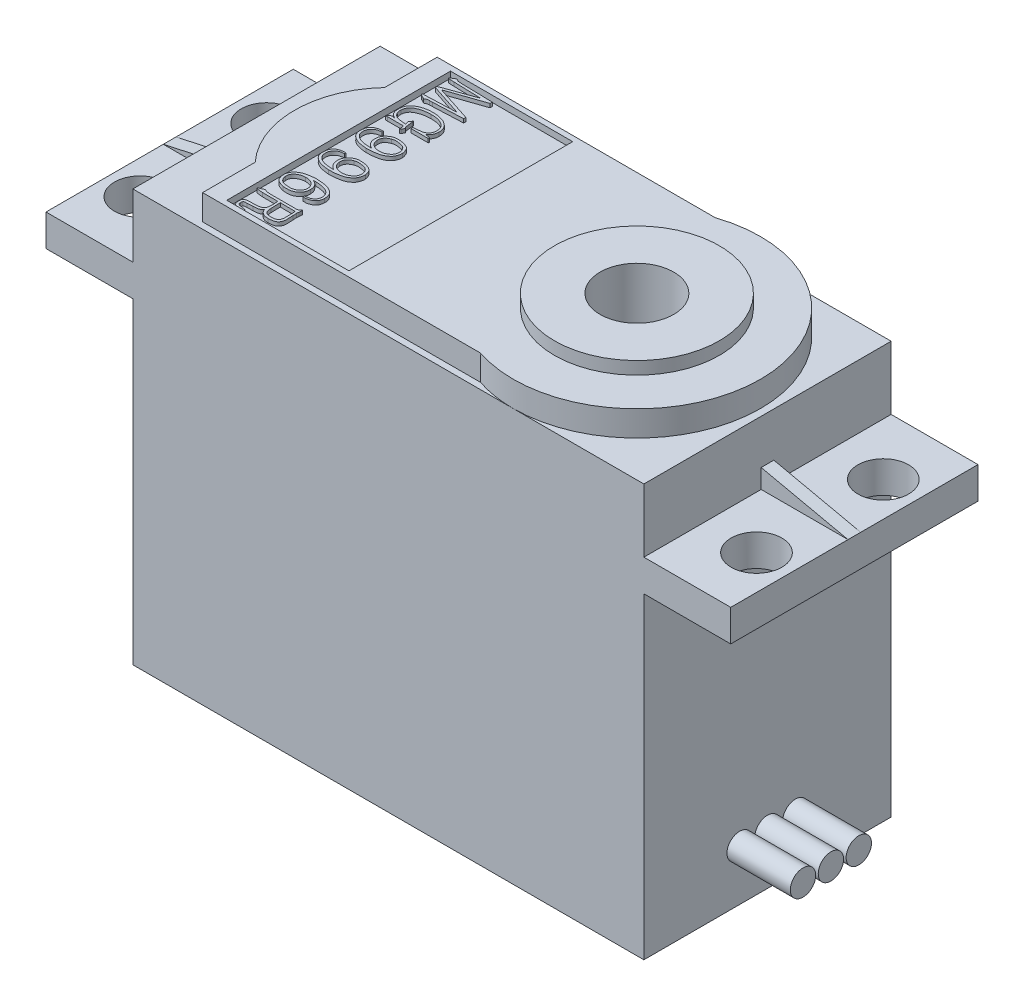
from build123d import *

# Parameters (mm, degrees)
SKETCH_1_W          = 40.3
SKETCH_1_H          = 19.5
EXTRUDE_1_DEPTH     = 27
SKETCH_2_W          = 54
SKETCH_2_H          = 19.5
EXTRUDE_2_DEPTH     = 2.5
SKETCH_3_W          = 40.3
SKETCH_3_H          = 19.5
EXTRUDE_3_DEPTH     = 5
EXTRUDE_4_DEPTH     = 2
RIB_1_REACH         = 48.436
SKETCH_5_WALL_W     = 101.884534654
SKETCH_5_WALL_H     = 1
RIB_2_REACH         = 48.436
SKETCH_6_WALL_W     = 101.884534654
SKETCH_6_WALL_H     = 1
SKETCH_7_R          = 6.5
EXTRUDE_5_DEPTH     = 1
SKETCH_8_R          = 2.9
CUT_EXTRUDE_1_DEPTH = 5
SKETCH_9_R          = 2
CUT_EXTRUDE_2_DEPTH = 5
CHAMFER_1_SIZE      = 2
SKETCH_10_W         = 9.636787174
SKETCH_10_H         = 17.646584306
CUT_EXTRUDE_3_DEPTH = 0.5
EXTRUDE_6_DEPTH     = 0.3
SKETCH_12_R         = 1
EXTRUDE_9_DEPTH     = 5


with BuildPart() as part:
    # 草图1 → 凸台-拉伸1 (new body)
    with BuildSketch(Plane(origin=(0, 0, 0), x_dir=(1, 0, 0), z_dir=(0, 1, 0))):
        Rectangle(SKETCH_1_W, SKETCH_1_H)
    extrude(amount=EXTRUDE_1_DEPTH)

    # 草图2 → 凸台-拉伸2 (add)
    with BuildSketch(Plane(origin=(0, 27, 0), x_dir=(1, 0, 0), z_dir=(0, 1, 0))):
        Rectangle(SKETCH_2_W, SKETCH_2_H)
    extrude(amount=EXTRUDE_2_DEPTH)

    # 草图3 → 凸台-拉伸3 (add)
    with BuildSketch(Plane(origin=(0, 29.5, 0), x_dir=(1, 0, 0), z_dir=(0, 1, 0))):
        Rectangle(SKETCH_3_W, SKETCH_3_H)
    extrude(amount=EXTRUDE_3_DEPTH)

    # 草图4 → 凸台-拉伸4 (add)
    with BuildSketch(Plane(origin=(0, 34.5, 0), x_dir=(1, 0, 0), z_dir=(0, 1, 0))):
        with BuildLine():
            Line((-15.15, -9.25), (-15.15, -5.099019514))
            ThreePointArc((-15.15, -5.099019514), (-17.15, 0), (-15.15, 5.099019514))
            Line((-15.15, 5.099019514), (-15.15, 9.25))
            Line((-15.15, 9.25), (6.767792999, 9.25))
            ThreePointArc((6.767792999, 9.25), (19.6, 0), (6.767792999, -9.25))
            Line((6.767792999, -9.25), (-15.15, -9.25))
        make_face()
    extrude(amount=EXTRUDE_4_DEPTH)

    # 草图5 wall → 筋1 (add, up to next)
    with BuildSketch(Plane(origin=(23.575, 30.25, 0), x_dir=(0.976853477736, -0.213909520672, 0), z_dir=(0.213909520672, 0.976853477736, 0)), mode=Mode.PRIVATE) as rib_1_sk1:
        Rectangle(SKETCH_5_WALL_W, SKETCH_5_WALL_H)
    rib_1_tool1 = extrude(rib_1_sk1.sketch, amount=-RIB_1_REACH, mode=Mode.PRIVATE) - part.part
    add(rib_1_tool1.solids().sort_by_distance((23.575, 30.25, 0))[0])

    # 草图6 wall → 筋2 (add, up to next)
    with BuildSketch(Plane(origin=(-23.575, 30.25, 0), x_dir=(-0.976853477736, -0.213909520672, 0), z_dir=(0.213909520672, -0.976853477736, 0)), mode=Mode.PRIVATE) as rib_2_sk1:
        Rectangle(SKETCH_6_WALL_W, SKETCH_6_WALL_H)
    rib_2_tool1 = extrude(rib_2_sk1.sketch, amount=RIB_2_REACH, mode=Mode.PRIVATE) - part.part
    add(rib_2_tool1.solids().sort_by_distance((-23.575, 30.25, 0))[0])

    # 草图7 → 凸台-拉伸5 (add)
    with BuildSketch(Plane(origin=(0, 36.5, 0), x_dir=(1, 0, 0), z_dir=(0, 1, 0))):
        with Locations(Location((9.85, 0, 0), (0, 0, 270))):
            Circle(SKETCH_7_R)
    extrude(amount=EXTRUDE_5_DEPTH)

    # 草图8 → 切除-拉伸1 (cut)
    with BuildSketch(Plane(origin=(0, 37.5, 0), x_dir=(1, 0, 0), z_dir=(0, 1, 0))):
        with Locations(Location((9.85, 0, 0), (0, 0, 270))):
            Circle(SKETCH_8_R)
    extrude(amount=-CUT_EXTRUDE_1_DEPTH, mode=Mode.SUBTRACT)

    # 草图9 → 切除-拉伸2 (cut)
    with BuildSketch(Plane(origin=(0, 29.5, 0), x_dir=(1, 0, 0), z_dir=(0, 1, 0))):
        with Locations(Location((-24.35, 5, 0), (0, 0, 270))):
            Circle(SKETCH_9_R)
        with Locations(Location((24.28, 5, 0), (0, 0, 270))):
            Circle(SKETCH_9_R)
        with Locations(Location((24.28, -5, 0), (0, 0, 270))):
            Circle(SKETCH_9_R)
        with Locations(Location((-24.35, -5, 0), (0, 0, 270))):
            Circle(SKETCH_9_R)
    extrude(amount=-CUT_EXTRUDE_2_DEPTH, mode=Mode.SUBTRACT)

    # 倒角1
    chamfer_1_edges = [part.edges().sort_by_distance(p)[0] for p in [
        (0, 0, 9.75),
        (-20.15, 0, 0),
        (0, 0, -9.75),
        (20.15, 0, 0),
    ]]
    chamfer(chamfer_1_edges, length=CHAMFER_1_SIZE)

    # 草图10 → 切除-拉伸3 (cut)
    with BuildSketch(Plane(origin=(0, 36.5, 0), x_dir=(1, 0, 0), z_dir=(0, 1, 0))):
        with Locations((-8.854580423, 0)):
            Rectangle(SKETCH_10_W, SKETCH_10_H)
    extrude(amount=-CUT_EXTRUDE_3_DEPTH, mode=Mode.SUBTRACT)

    # 草图11 → 凸台-拉伸6 (add)
    # profile 1 of 6: a face of its own
    with BuildSketch(Plane(origin=(0, 36, 0), x_dir=(1, 0, 0), z_dir=(0, 1, 0))):
        with BuildLine():
            Line((-10.108835932, 6.465099099), (-10.108835932, 6.292075447))
            Line((-10.108835932, 6.292075447), (-12.470012152, 6.186918831))
            Line((-12.470012152, 6.186918831), (-12.691512258, 6.179460915))
            add(Edge.make_bspline(
                [(-12.691512258, 6.179460915), (-12.704682236, 6.179133247), (-12.729283425, 6.178521171), (-12.76346004, 6.178820017), (-12.791956525, 6.175085343), (-12.82366459, 6.171706911), (-12.861096032, 6.161497876), (-12.905501006, 6.14652074), (-12.948600061, 6.12856097), (-12.983579582, 6.105935535), (-13.009940886, 6.088203492), (-13.030941587, 6.076001018), (-13.052071154, 6.081143252), (-13.07675673, 6.092617885), (-13.114417302, 6.110357592), (-13.1428217, 6.125832205), (-13.159123594, 6.134713418)],
                knots=[0, 0, 0, 0, 1.102701008, 2.059818031, 2.854660456, 3.504867835, 4.725821617, 6.087517188, 7.428720521, 8.623884165, 9.541296161, 10.147772796, 10.527373255, 11.292252643, 12.445965619, 14, 14, 14, 14], degree=3))
            Line((-13.159123594, 6.134713418), (-13.330655663, 6.217496286))
            add(Edge.make_bspline(
                [(-13.330655663, 6.217496286), (-13.346301752, 6.226705906), (-13.373957393, 6.242984603), (-13.410242295, 6.264089838), (-13.434260872, 6.280820261), (-13.451111532, 6.295883627), (-13.457639739, 6.312784037), (-13.460491623, 6.329808581), (-13.454018711, 6.344742876), (-13.445383369, 6.349890937), (-13.441032821, 6.352484567)],
                knots=[0, 0, 0, 0, 2.092832486, 3.699239191, 4.828075347, 5.47623227, 6.258606608, 6.862868476, 7.427104806, 8, 8, 8, 8], degree=3))
            add(Edge.make_bspline(
                [(-13.441032821, 6.352484567), (-13.435046209, 6.357006622), (-13.420471597, 6.368015719), (-13.386613915, 6.370427585), (-13.342683956, 6.368829873), (-13.309272674, 6.363152374), (-13.290382917, 6.359942483)],
                knots=[0, 0, 0, 0, 0.570562757, 1.389054623, 2.523848169, 4, 4, 4, 4], degree=3))
            Line((-13.290382917, 6.359942483), (-12.973421485, 6.374858315))
            Line((-12.973421485, 6.374858315), (-10.793472625, 6.465099099))
            Line((-10.793472625, 6.465099099), (-13.350792036, 7.306352029))
            Line((-13.350792036, 7.306352029), (-13.345571495, 7.448798226))
            Line((-13.345571495, 7.448798226), (-10.823304289, 8.357918191))
            Line((-10.823304289, 8.357918191), (-12.998032608, 8.41758152))
            Line((-12.998032608, 8.41758152), (-13.31051929, 8.432497352))
            add(Edge.make_bspline(
                [(-13.31051929, 8.432497352), (-13.333162395, 8.433096925), (-13.373834867, 8.434173904), (-13.421285793, 8.442738496), (-13.449423132, 8.454520513), (-13.463828559, 8.462840882), (-13.47192037, 8.474097008), (-13.471707613, 8.481885371), (-13.471610276, 8.485448556)],
                knots=[0, 0, 0, 0, 2.238805083, 4.021433183, 4.714937999, 5.246364549, 5.655210975, 6, 6, 6, 6], degree=3))
            add(Edge.make_bspline(
                [(-13.471610276, 8.485448556), (-13.471003507, 8.490422698), (-13.469760989, 8.500608544), (-13.464368444, 8.518920478), (-13.441676521, 8.536983875), (-13.414414844, 8.549644392), (-13.389590289, 8.562388056), (-13.373328787, 8.568741699), (-13.363189557, 8.57381118), (-13.357766391, 8.57523038), (-13.356012578, 8.57568934)],
                knots=[0, 0, 0, 0, 0.773964204, 1.584892381, 2.85704835, 5.031717749, 6.264108979, 7.138477416, 7.721389708, 8, 8, 8, 8], degree=3))
            Line((-13.356012578, 8.57568934), (-13.12929193, 8.71067762))
            add(Edge.make_bspline(
                [(-13.12929193, 8.71067762), (-13.118000132, 8.714835489), (-13.096054756, 8.722916221), (-13.059642734, 8.719188617), (-13.021934201, 8.706021239), (-12.983971195, 8.684010086), (-12.947744176, 8.664578412), (-12.922530612, 8.648111569), (-12.902132595, 8.640318917), (-12.88212722, 8.635425917), (-12.855703991, 8.631003339), (-12.824755874, 8.627925206), (-12.793918658, 8.624541087), (-12.76736622, 8.621186615), (-12.747347371, 8.619676373), (-12.733594573, 8.616659085), (-12.721571031, 8.615919225), (-12.707482285, 8.613910168), (-12.687009353, 8.613953079), (-12.660454325, 8.611939052), (-12.62762641, 8.610625844), (-12.588826672, 8.609354422), (-12.543871504, 8.606605495), (-12.511781227, 8.605898838), (-12.494623275, 8.605521004)],
                knots=[0, 0, 0, 0, 1.194424872, 2.321340004, 3.585598028, 5.195084956, 6.716837907, 7.724099835, 8.206680761, 8.903637039, 9.790942755, 10.897450691, 12.028789452, 12.90903052, 13.587833776, 14.043805438, 14.319796903, 14.797174648, 15.472288729, 16.373211185, 17.473778476, 18.774068007, 20.27516646, 22, 22, 22, 22], degree=3))
            Line((-12.494623275, 8.605521004), (-10.108835932, 8.5525698))
            Line((-10.108835932, 8.5525698), (-10.108835932, 8.372834024))
            Line((-10.108835932, 8.372834024), (-12.957759861, 7.389134897))
            Line((-12.957759861, 7.389134897), (-10.108835932, 6.465099099))
        make_face()
    # profile 2 of 6: a face of its own
    with BuildSketch(Plane(origin=(0, 36, 0), x_dir=(1, 0, 0), z_dir=(0, 1, 0))):
        with BuildLine():
            add(Edge.make_bspline(
                [(-12.016570856, 3.633097388), (-12.021647518, 3.652280636), (-12.03076964, 3.68675051), (-12.044719979, 3.731948407), (-12.053858919, 3.765503045), (-12.059780228, 3.783512837), (-12.062064144, 3.790459417)],
                knots=[0, 0, 0, 0, 1.45335447, 2.611494566, 3.464437835, 4, 4, 4, 4], degree=3))
            Line((-12.062064144, 3.790459417), (-12.091895808, 3.880700201))
            Line((-12.091895808, 3.880700201), (-11.961382277, 4.091013434))
            add(Edge.make_bspline(
                [(-11.961382277, 4.091013434), (-11.95764498, 4.098911304), (-11.951203836, 4.112523098), (-11.9402981, 4.127653424), (-11.932880434, 4.139131161), (-11.921639555, 4.141195757), (-11.912024596, 4.136085521), (-11.902286107, 4.128530848), (-11.895018331, 4.115280171), (-11.892214574, 4.104775229), (-11.890532075, 4.09847135)],
                knots=[0, 0, 0, 0, 1.721478549, 2.96692782, 3.770230587, 4.273468087, 5.07068514, 5.841502061, 6.704713207, 8, 8, 8, 8], degree=3))
            Line((-11.890532075, 4.09847135), (-11.890532075, 3.918735573))
            Line((-11.890532075, 3.918735573), (-11.865920952, 3.760627753))
            Line((-11.865920952, 3.760627753), (-11.840564037, 3.565230352))
            add(Edge.make_bspline(
                [(-11.840564037, 3.565230352), (-11.840162028, 3.559252954), (-11.839235864, 3.545481981), (-11.835041955, 3.522132366), (-11.829179632, 3.492957832), (-11.820824383, 3.460321199), (-11.810937942, 3.428741104), (-11.801494117, 3.402090312), (-11.791997148, 3.382421014), (-11.783550362, 3.373442244), (-11.780154917, 3.369832952)],
                knots=[0, 0, 0, 0, 0.693923818, 1.598689782, 2.745819235, 4.143502487, 5.501415895, 6.57721006, 7.428066009, 8, 8, 8, 8], degree=3))
            Line((-11.780154917, 3.369832952), (-11.729441088, 3.325085456))
            Line((-11.729441088, 3.325085456), (-11.865920952, 3.099856391))
            add(Edge.make_bspline(
                [(-11.865920952, 3.099856391), (-11.87243382, 3.091409429), (-11.884179754, 3.076175366), (-11.909245223, 3.068627838), (-11.930942215, 3.070906442), (-11.938114446, 3.080675364), (-11.941245904, 3.084940559)],
                knots=[0, 0, 0, 0, 1.365288393, 2.462292284, 3.328623616, 4, 4, 4, 4], degree=3))
            Line((-11.941245904, 3.084940559), (-11.946466445, 3.137145971))
            Line((-11.946466445, 3.137145971), (-11.976298109, 3.422784156))
            Line((-11.976298109, 3.422784156), (-13.229973797, 3.422784156))
            add(Edge.make_bspline(
                [(-13.229973797, 3.422784156), (-13.244392973, 3.422738407), (-13.271493518, 3.422652422), (-13.309039452, 3.423205097), (-13.340625763, 3.42499793), (-13.365941229, 3.426048294), (-13.385578137, 3.428418335), (-13.398365183, 3.430384001), (-13.407429015, 3.432443232), (-13.411696813, 3.445012453), (-13.385309586, 3.460625178), (-13.36488436, 3.486651192), (-13.336295309, 3.511054655), (-13.317530409, 3.523347721), (-13.31051929, 3.527940772)],
                knots=[0, 0, 0, 0, 1.639098295, 3.080651418, 4.268929633, 5.231441294, 5.971084531, 6.486786894, 6.765118723, 6.917305179, 7.861808722, 9.440596986, 11.043731724, 12, 12, 12, 12], degree=3))
            Line((-13.31051929, 3.527940772), (-13.244889629, 3.565230352))
            Line((-13.244889629, 3.565230352), (-13.159123594, 3.633097388))
            add(Edge.make_bspline(
                [(-13.159123594, 3.633097388), (-13.146154335, 3.644078661), (-13.123962245, 3.662869046), (-13.095589921, 3.668179848), (-13.083798642, 3.670386969)],
                knots=[0, 0, 0, 0, 1.168818219, 2, 2, 2, 2], degree=3))
            Line((-13.083798642, 3.670386969), (-13.033830605, 3.64801322))
            Line((-13.033830605, 3.64801322), (-12.852603245, 3.603265724))
            add(Edge.make_bspline(
                [(-12.852603245, 3.603265724), (-12.867399777, 3.612186044), (-12.903250392, 3.633799144), (-12.968893526, 3.664498462), (-13.047123989, 3.711006729), (-13.117809344, 3.760299608), (-13.174934311, 3.811766987), (-13.213339127, 3.862889077), (-13.248589014, 3.922388097), (-13.279385523, 3.990143332), (-13.303949319, 4.064058483), (-13.323898904, 4.140922715), (-13.335616519, 4.220456159), (-13.338762673, 4.274196694), (-13.340350954, 4.301326666)],
                knots=[0, 0, 0, 0, 0.682902113, 1.654608042, 2.861894888, 4.27790553, 5.056999099, 5.890804738, 6.7945336, 7.788805481, 8.827203978, 9.871588867, 10.925508771, 12, 12, 12, 12], degree=3))
            add(Edge.make_bspline(
                [(-13.340350954, 4.301326666), (-13.341940522, 4.350836096), (-13.345091513, 4.448978324), (-13.326442491, 4.592912429), (-13.292190675, 4.726681274), (-13.25368063, 4.830601442), (-13.213612534, 4.906343899), (-13.177069526, 4.960352736), (-13.135370597, 5.013586381), (-13.086579538, 5.065131773), (-13.030565256, 5.115198821), (-12.968467346, 5.165453956), (-12.897407972, 5.212437881), (-12.821414587, 5.26072982), (-12.73809616, 5.304610792), (-12.649992499, 5.346457258), (-12.555596708, 5.381607507), (-12.457731362, 5.413206976), (-12.358925393, 5.440526842), (-12.262587694, 5.46268715), (-12.170095629, 5.480355716), (-12.0495276, 5.496170554), (-11.893992789, 5.507582247), (-11.698364174, 5.512172169), (-11.490086988, 5.505114558), (-11.348942954, 5.483844991), (-11.276745584, 5.472965277)],
                knots=[0, 0, 0, 0, 1.296855289, 2.57074797, 3.787781431, 4.912090985, 5.466017155, 6.029935049, 6.619226251, 7.236981103, 7.887517514, 8.587730122, 9.328811339, 10.1190631, 10.947078726, 11.7954872, 12.674165492, 13.585070334, 14.490996303, 15.360442995, 16.175900064, 16.95837495, 18.546785394, 20.261144089, 22.087517035, 24, 24, 24, 24], degree=3))
            add(Edge.make_bspline(
                [(-11.276745584, 5.472965277), (-11.216348356, 5.460773639), (-11.091172659, 5.435505976), (-10.936361232, 5.387401561), (-10.81054485, 5.339150776), (-10.716945988, 5.294161799), (-10.626009385, 5.2411581), (-10.539301178, 5.181241338), (-10.458164336, 5.117914641), (-10.38874973, 5.049025594), (-10.330268829, 4.977785742), (-10.28462195, 4.904086956), (-10.249144363, 4.832119898), (-10.219122017, 4.765825903), (-10.198344634, 4.704467913), (-10.178965571, 4.62962431), (-10.166206376, 4.535641468), (-10.161318651, 4.460208543), (-10.158803969, 4.421399114)],
                knots=[0, 0, 0, 0, 1.756852838, 3.641148545, 4.615675158, 5.598961219, 6.599988407, 7.614985252, 8.604008524, 9.53171328, 10.398925515, 11.227312903, 11.997988587, 12.687082964, 13.301564504, 13.84336769, 14.890435854, 16, 16, 16, 16], degree=3))
            add(Edge.make_bspline(
                [(-10.158803969, 4.421399114), (-10.159141256, 4.39701416), (-10.159800316, 4.349365888), (-10.167630771, 4.279849194), (-10.179363786, 4.213999276), (-10.201223391, 4.131357165), (-10.2408323, 4.032759587), (-10.296319275, 3.943804905), (-10.343832513, 3.880375629), (-10.374724041, 3.840206157), (-10.400800081, 3.808079983), (-10.418222387, 3.790601084), (-10.425797364, 3.783001501)],
                knots=[0, 0, 0, 0, 1.02865205, 2.009989184, 2.948380583, 3.849248544, 5.614353784, 7.40828352, 8.256022902, 8.959034023, 9.547402437, 10, 10, 10, 10], degree=3))
            Line((-10.425797364, 3.783001501), (-10.506342857, 3.723338172))
            Line((-10.506342857, 3.723338172), (-10.149108678, 3.633097388))
            Line((-10.149108678, 3.633097388), (-10.149108678, 3.542856604))
            Line((-10.149108678, 3.542856604), (-11.513161523, 3.542856604))
            Line((-11.513161523, 3.542856604), (-11.518382064, 3.700964424))
            add(Edge.make_bspline(
                [(-11.518382064, 3.700964424), (-11.494516912, 3.700993837), (-11.443306274, 3.701056952), (-11.362996534, 3.700518785), (-11.277679241, 3.702741595), (-11.204310309, 3.706944425), (-11.142412917, 3.71285101), (-11.089765308, 3.719851413), (-11.030540559, 3.727917603), (-10.945737283, 3.741418456), (-10.843168344, 3.761391359), (-10.728025613, 3.794020556), (-10.624300382, 3.846026221), (-10.545049291, 3.90394052), (-10.486576367, 3.9598194), (-10.448308991, 4.006569324), (-10.415692478, 4.056163292), (-10.389682737, 4.109701182), (-10.368430427, 4.166860401), (-10.353527533, 4.228313927), (-10.340794228, 4.293429615), (-10.337334012, 4.33855561), (-10.335556579, 4.361735786)],
                knots=[0, 0, 0, 0, 0.935739115, 2.007940184, 3.148747064, 4.28148865, 4.888643423, 5.586238389, 6.363702558, 7.232250513, 8.952694186, 10.46050143, 11.907734915, 13.477168468, 14.290584882, 15.073104099, 15.840915301, 16.612491364, 17.401961071, 18.22703269, 19.08926784, 20, 20, 20, 20], degree=3))
            add(Edge.make_bspline(
                [(-10.335556579, 4.361735786), (-10.335580197, 4.397066303), (-10.335625925, 4.465472279), (-10.347582513, 4.565124053), (-10.37015442, 4.65780567), (-10.401475804, 4.745057683), (-10.444097366, 4.826727585), (-10.500686167, 4.901700191), (-10.567916464, 4.972556241), (-10.647656039, 5.035118281), (-10.733041407, 5.091670803), (-10.8214353, 5.141257933), (-10.911764576, 5.182876201), (-11.00429001, 5.213827957), (-11.09535869, 5.240115387), (-11.184887601, 5.25998781), (-11.271589532, 5.276293122), (-11.384409812, 5.288266877), (-11.523188684, 5.297704281), (-11.633961755, 5.29919746), (-11.689168342, 5.299941624)],
                knots=[0, 0, 0, 0, 1.020336309, 1.975547117, 2.892045996, 3.771563378, 4.648848181, 5.542539332, 6.477435802, 7.463615751, 8.463825308, 9.435109215, 10.389941754, 11.332781131, 12.251473469, 13.128081502, 13.982025083, 14.799156052, 16.404777764, 18, 18, 18, 18], degree=3))
            add(Edge.make_bspline(
                [(-11.689168342, 5.299941624), (-11.724974246, 5.299471703), (-11.798136937, 5.298511507), (-11.909638669, 5.291772929), (-12.025001156, 5.279418405), (-12.14221632, 5.263456395), (-12.258135948, 5.243300153), (-12.368366602, 5.217110383), (-12.471587762, 5.186846331), (-12.566628434, 5.151572511), (-12.653503114, 5.11472244), (-12.730847334, 5.076515869), (-12.799523511, 5.039492682), (-12.859015828, 5.00117928), (-12.911027122, 4.961688993), (-12.958378925, 4.921762301), (-12.998043298, 4.877093274), (-13.045568035, 4.817749644), (-13.091724475, 4.738586852), (-13.134206575, 4.639833837), (-13.161405891, 4.533647798), (-13.166770118, 4.459846685), (-13.169564677, 4.421399114)],
                knots=[0, 0, 0, 0, 1.126994854, 2.302803905, 3.514286971, 4.778011192, 6.025865863, 7.215856767, 8.342308229, 9.409248108, 10.404825957, 11.311169663, 12.123616097, 12.859383373, 13.535435401, 14.178772448, 14.804598141, 15.411954719, 16.570030134, 17.674526722, 18.788516934, 20, 20, 20, 20], degree=3))
            add(Edge.make_bspline(
                [(-13.169564677, 4.421399114), (-13.16985608, 4.386316288), (-13.170441224, 4.315869475), (-13.157030293, 4.210912261), (-13.129869876, 4.109408321), (-13.087395742, 4.013953017), (-13.027141284, 3.928054887), (-12.952783995, 3.851832096), (-12.864987057, 3.789441367), (-12.767751494, 3.743352468), (-12.666254484, 3.71188741), (-12.564462631, 3.687752023), (-12.465114221, 3.673085447), (-12.368574285, 3.658374033), (-12.2702776, 3.647930969), (-12.203034871, 3.6430834), (-12.167966552, 3.640555304)],
                knots=[0, 0, 0, 0, 1.012518681, 2.033151841, 3.045161207, 4.038142276, 5.034026654, 6.059673631, 7.099696739, 8.127377512, 9.153727986, 10.16390169, 11.146023905, 12.052814435, 12.984506943, 14, 14, 14, 14], degree=3))
            Line((-12.167966552, 3.640555304), (-12.016570856, 3.633097388))
        make_face()
    # profile 3 of 6: a face of its own
    with BuildSketch(Plane(origin=(0, 36, 0), x_dir=(1, 0, 0), z_dir=(0, 1, 0))):
        with BuildLine():
            Line((-12.414077781, 2.268813555), (-12.414077781, 2.163656939))
            add(Edge.make_bspline(
                [(-12.414077781, 2.163656939), (-12.44542573, 2.160668995), (-12.507048225, 2.15479542), (-12.599993343, 2.141611829), (-12.696043038, 2.119254882), (-12.779345352, 2.091657499), (-12.849455582, 2.061763536), (-12.90176306, 2.029299544), (-12.954267596, 1.991653222), (-13.004197507, 1.946110866), (-13.051863982, 1.895943641), (-13.09468963, 1.840664874), (-13.131044182, 1.780210269), (-13.163353959, 1.716833701), (-13.188384197, 1.649106561), (-13.204328061, 1.577873112), (-13.213950786, 1.503412625), (-13.212825702, 1.427435802), (-13.207542935, 1.353594204), (-13.195936167, 1.28540785), (-13.181675372, 1.223692734), (-13.161066901, 1.167376939), (-13.132366663, 1.113616899), (-13.092264796, 1.060977341), (-13.043956236, 1.004929239), (-12.985498039, 0.947722114), (-12.916594011, 0.893202795), (-12.838495744, 0.842610722), (-12.750613574, 0.79907992), (-12.654824026, 0.760562789), (-12.551714342, 0.727991537), (-12.443203192, 0.701101815), (-12.32995949, 0.676969593), (-12.252330612, 0.666814914), (-12.212714048, 0.661632647)],
                knots=[0, 0, 0, 0, 1.161562506, 2.283351267, 3.460054047, 4.793976417, 5.516494263, 6.265077708, 7.059282141, 7.896977086, 8.753286989, 9.609842358, 10.470120195, 11.351831039, 12.23086742, 13.125078708, 14.039560616, 14.993248057, 15.92232611, 16.76806327, 17.542052076, 18.255787675, 18.973752159, 19.780770556, 20.690874171, 21.702495583, 22.792346145, 23.926806676, 25.12840101, 26.40383237, 27.73206904, 29.113223073, 30.526782984, 32, 32, 32, 32], degree=3))
            Line((-12.212714048, 0.661632647), (-11.915888989, 0.646716815))
            Line((-11.915888989, 0.646716815), (-11.719745797, 0.639258899))
            add(Edge.make_bspline(
                [(-11.719745797, 0.639258899), (-11.739747007, 0.649746172), (-11.777613157, 0.669600603), (-11.829647537, 0.700882217), (-11.875894713, 0.727884953), (-11.929015728, 0.761979623), (-11.988661304, 0.812380244), (-12.043950603, 0.870692419), (-12.085779294, 0.926515077), (-12.117480445, 0.975061982), (-12.14630396, 1.030681831), (-12.177392739, 1.090661998), (-12.202692749, 1.158498399), (-12.220518193, 1.234120407), (-12.230705647, 1.317153045), (-12.232116873, 1.375077846), (-12.232850421, 1.405186877)],
                knots=[0, 0, 0, 0, 0.96811683, 1.832831972, 2.602442467, 3.264690643, 4.536676004, 5.939331142, 6.700405402, 7.525311046, 8.421957077, 9.384896146, 10.420381823, 11.516576881, 12.70912866, 14, 14, 14, 14], degree=3))
            add(Edge.make_bspline(
                [(-12.232850421, 1.405186877), (-12.232715044, 1.449026481), (-12.232449848, 1.534905208), (-12.212699941, 1.640486274), (-12.186644903, 1.719994074), (-12.162684317, 1.778346849), (-12.132631424, 1.834798489), (-12.097562987, 1.890410817), (-12.055776597, 1.94448805), (-12.008560622, 1.997956038), (-11.953797877, 2.049877041), (-11.893834962, 2.10023768), (-11.830173425, 2.147798751), (-11.762997505, 2.188242095), (-11.694714092, 2.222513156), (-11.62396715, 2.250845196), (-11.549306263, 2.272538726), (-11.469224025, 2.288256456), (-11.382844054, 2.296882908), (-11.260569601, 2.300125219), (-11.106204748, 2.294580826), (-10.98404056, 2.277305763), (-10.923986155, 2.268813555)],
                knots=[0, 0, 0, 0, 1.441778134, 2.824342836, 3.513038675, 4.195722577, 4.898866133, 5.616586851, 6.358372924, 7.147065104, 7.963527037, 8.8409299, 9.725181631, 10.577472986, 11.419597639, 12.23905066, 13.08363918, 13.976378112, 14.923014095, 15.938750632, 18.003540029, 20, 20, 20, 20], degree=3))
            add(Edge.make_bspline(
                [(-10.923986155, 2.268813555), (-10.89431214, 2.263797098), (-10.832400256, 2.253330757), (-10.736909571, 2.227575847), (-10.636121448, 2.190028632), (-10.548601466, 2.153968912), (-10.479055449, 2.119308712), (-10.430340779, 2.089427208), (-10.386378535, 2.056477276), (-10.346184972, 2.021323467), (-10.310999484, 1.98261503), (-10.281502191, 1.94023537), (-10.254374513, 1.896272028), (-10.228587781, 1.833771264), (-10.202149444, 1.758760775), (-10.175310411, 1.675493616), (-10.157268708, 1.601213243), (-10.151693191, 1.554411864), (-10.149108678, 1.532717242)],
                knots=[0, 0, 0, 0, 1.232643308, 2.571787759, 4.044217922, 5.637139245, 6.447978167, 7.225371298, 7.975044785, 8.696580882, 9.410528117, 10.111496744, 10.810241716, 11.521787165, 12.874996824, 14.070206042, 15.105450454, 16, 16, 16, 16], degree=3))
            add(Edge.make_bspline(
                [(-10.149108678, 1.532717242), (-10.148474471, 1.497131692), (-10.147174111, 1.424168163), (-10.159725114, 1.331624044), (-10.176970542, 1.253800505), (-10.197746889, 1.190486256), (-10.223945955, 1.122101322), (-10.256518063, 1.050671028), (-10.296219652, 0.979619787), (-10.342981608, 0.912505364), (-10.398816039, 0.852768739), (-10.481218537, 0.782401301), (-10.590159926, 0.706551752), (-10.702718624, 0.636388884), (-10.802451085, 0.591070664), (-10.890407058, 0.560855999), (-10.991901327, 0.533690314), (-11.102061735, 0.510277211), (-11.210922839, 0.49216258), (-11.307638352, 0.474093707), (-11.388361881, 0.46199144), (-11.475294925, 0.448049735), (-11.579819865, 0.438001365), (-11.705515358, 0.432235999), (-11.827623089, 0.429412303), (-11.90569547, 0.429091668), (-11.941245904, 0.428945667)],
                knots=[0, 0, 0, 0, 1.074749016, 2.203632703, 2.812577277, 3.482852542, 4.21560841, 5.02606841, 5.853870657, 6.673375128, 7.49239699, 8.318183911, 9.94494759, 11.501953483, 12.319249415, 13.250994979, 14.31026013, 15.493928427, 16.654173563, 17.646367651, 18.468040354, 19.121719855, 20.307771699, 21.639741468, 22.925250984, 24, 24, 24, 24], degree=3))
            add(Edge.make_bspline(
                [(-11.941245904, 0.428945667), (-12.000685926, 0.434376772), (-12.114260558, 0.44475422), (-12.277414462, 0.464219139), (-12.427770637, 0.490523193), (-12.570046067, 0.519513745), (-12.706224597, 0.562023525), (-12.817501853, 0.604801875), (-12.905087559, 0.649661861), (-12.971897296, 0.690068724), (-13.040066252, 0.736383915), (-13.107031353, 0.788402602), (-13.170946404, 0.842944433), (-13.223552267, 0.902912875), (-13.268981409, 0.961934293), (-13.301039695, 1.024074528), (-13.326762685, 1.084540206), (-13.345285203, 1.143609361), (-13.362131971, 1.199424493), (-13.374075378, 1.270792387), (-13.382555685, 1.356503448), (-13.381257206, 1.424310441), (-13.380623701, 1.457392289)],
                knots=[0, 0, 0, 0, 1.797086707, 3.433771622, 4.944792553, 6.392286608, 7.801005391, 9.235339341, 9.97510545, 10.760669027, 11.584826592, 12.454621118, 13.313625219, 14.108616606, 14.852611278, 15.549122826, 16.2066196, 16.829103701, 17.412039301, 17.959645049, 19.004546411, 20, 20, 20, 20], degree=3))
            add(Edge.make_bspline(
                [(-13.380623701, 1.457392289), (-13.379313013, 1.487006255), (-13.376738072, 1.545185052), (-13.365561483, 1.630803976), (-13.347341854, 1.712666905), (-13.324631, 1.791253172), (-13.295406691, 1.865275995), (-13.257361751, 1.932515738), (-13.214599542, 1.994596289), (-13.162874758, 2.048584025), (-13.104967765, 2.096337999), (-13.041280993, 2.139323172), (-12.970830276, 2.175706373), (-12.894047871, 2.20626343), (-12.810812333, 2.231774385), (-12.720267489, 2.25107432), (-12.622461033, 2.263564744), (-12.554818462, 2.267029226), (-12.519980189, 2.268813555)],
                knots=[0, 0, 0, 0, 1.06190317, 2.086186327, 3.089135659, 4.064405996, 5.01557864, 5.932729571, 6.827456307, 7.709678761, 8.601607318, 9.513290962, 10.457597657, 11.436887401, 12.471039678, 13.57352987, 14.750283629, 16, 16, 16, 16], degree=3))
            Line((-12.519980189, 2.268813555), (-12.414077781, 2.268813555))
        make_face()
        with BuildLine():
            add(Edge.make_bspline(
                [(-11.196200091, 0.744415516), (-11.150823587, 0.746424174), (-11.059260051, 0.750477369), (-10.945739471, 0.774447421), (-10.854977302, 0.80242442), (-10.786602189, 0.831424657), (-10.71742748, 0.864739449), (-10.649485937, 0.905058896), (-10.58278847, 0.9502622), (-10.522824061, 1.004268871), (-10.468188136, 1.064088263), (-10.419617849, 1.129973522), (-10.379439108, 1.203260131), (-10.351538886, 1.284354291), (-10.336806537, 1.372564312), (-10.335981547, 1.433474315), (-10.335556579, 1.464850206)],
                knots=[0, 0, 0, 0, 1.5235734, 3.074361288, 3.879823378, 4.710974347, 5.566147304, 6.45690185, 7.362598751, 8.267525502, 9.160039468, 10.080284655, 11.010589524, 11.955949148, 12.947070884, 14, 14, 14, 14], degree=3))
            add(Edge.make_bspline(
                [(-10.335556579, 1.464850206), (-10.337202096, 1.493303378), (-10.340469652, 1.549803798), (-10.360299511, 1.632611919), (-10.38885597, 1.712962616), (-10.429552392, 1.787784808), (-10.475125428, 1.856310019), (-10.526344562, 1.914737625), (-10.581303574, 1.961692556), (-10.641842281, 1.996052967), (-10.706519032, 2.021340218), (-10.775167609, 2.045143659), (-10.850155793, 2.063358723), (-10.95534793, 2.082308783), (-11.08566123, 2.099280248), (-11.213831773, 2.111305566), (-11.31489447, 2.111778411), (-11.393042917, 2.10020069), (-11.475404469, 2.081237357), (-11.530249563, 2.061345008), (-11.558654811, 2.051042407)],
                knots=[0, 0, 0, 0, 0.972972678, 1.932064543, 2.900345298, 3.881603781, 4.836654803, 5.710067057, 6.530870687, 7.29649367, 8.078048887, 8.903463193, 9.779849899, 10.713699583, 12.55822633, 14.272574297, 15.114335027, 16.006539535, 16.967551431, 18, 18, 18, 18], degree=3))
            add(Edge.make_bspline(
                [(-11.558654811, 2.051042407), (-11.582756421, 2.042916042), (-11.631330738, 2.026538188), (-11.700429798, 1.991185259), (-11.768202538, 1.950512029), (-11.831134617, 1.901813345), (-11.887832833, 1.848695459), (-11.937294598, 1.793837109), (-11.975371307, 1.735631963), (-12.005321294, 1.676222568), (-12.025171898, 1.613896163), (-12.03884212, 1.549477259), (-12.044988698, 1.481844146), (-12.042961517, 1.436015023), (-12.041927771, 1.412644793)],
                knots=[0, 0, 0, 0, 1.054537953, 2.125312858, 3.213844798, 4.332630889, 5.420575597, 6.437056958, 7.390216681, 8.299455536, 9.190412501, 10.097188084, 11.029674824, 12, 12, 12, 12], degree=3))
            add(Edge.make_bspline(
                [(-12.041927771, 1.412644793), (-12.040389102, 1.384722069), (-12.037384091, 1.330189149), (-12.021263967, 1.251611784), (-11.997600604, 1.178600848), (-11.965421964, 1.112171304), (-11.926962421, 1.053195476), (-11.887376204, 0.999833047), (-11.844175117, 0.954744132), (-11.798644518, 0.915306476), (-11.746954765, 0.882488637), (-11.690503807, 0.851180422), (-11.627229987, 0.821918907), (-11.557096535, 0.795219976), (-11.479271682, 0.771047187), (-11.392222627, 0.756868924), (-11.297184423, 0.745379757), (-11.230797707, 0.744745868), (-11.196200091, 0.744415516)],
                knots=[0, 0, 0, 0, 1.11008112, 2.167982033, 3.177103922, 4.15363553, 5.090948019, 5.972227589, 6.789849659, 7.567832268, 8.359741834, 9.217618185, 10.132587918, 11.127046302, 12.199198304, 13.363859354, 14.626168178, 16, 16, 16, 16], degree=3))
        make_face(mode=Mode.SUBTRACT)
    # profile 4 of 6: a face of its own
    with BuildSketch(Plane(origin=(0, 36, 0), x_dir=(1, 0, 0), z_dir=(0, 1, 0))):
        with BuildLine():
            Line((-12.414077781, -0.687735354), (-12.414077781, -0.79289197))
            add(Edge.make_bspline(
                [(-12.414077781, -0.79289197), (-12.44542573, -0.795879914), (-12.507048225, -0.801753489), (-12.599993343, -0.81493708), (-12.696043038, -0.837294027), (-12.779345352, -0.864891409), (-12.849455582, -0.894785373), (-12.90176306, -0.927249365), (-12.954267596, -0.964895687), (-13.004197507, -1.010438043), (-13.051863982, -1.060605268), (-13.09468963, -1.115884035), (-13.131044182, -1.17633864), (-13.163353959, -1.239715208), (-13.188384197, -1.307442348), (-13.204328061, -1.378675797), (-13.213950786, -1.453136284), (-13.212825702, -1.529113107), (-13.207542935, -1.602954705), (-13.195936167, -1.671141058), (-13.181675372, -1.732856174), (-13.161066901, -1.78917197), (-13.132366663, -1.84293201), (-13.092264796, -1.895571568), (-13.043956236, -1.95161967), (-12.985498039, -2.008826794), (-12.916594011, -2.063346114), (-12.838495744, -2.113938187), (-12.750613574, -2.157468989), (-12.654824026, -2.19598612), (-12.551714342, -2.228557372), (-12.443203192, -2.255447094), (-12.32995949, -2.279579315), (-12.252330612, -2.289733995), (-12.212714048, -2.294916261)],
                knots=[0, 0, 0, 0, 1.161562506, 2.283351267, 3.460054047, 4.793976417, 5.516494263, 6.265077708, 7.059282141, 7.896977086, 8.753286989, 9.609842358, 10.470120195, 11.351831039, 12.23086742, 13.125078708, 14.039560616, 14.993248057, 15.92232611, 16.76806327, 17.542052076, 18.255787675, 18.973752159, 19.780770556, 20.690874171, 21.702495583, 22.792346145, 23.926806676, 25.12840101, 26.40383237, 27.73206904, 29.113223073, 30.526782984, 32, 32, 32, 32], degree=3))
            Line((-12.212714048, -2.294916261), (-11.915888989, -2.309832093))
            Line((-11.915888989, -2.309832093), (-11.719745797, -2.317290009))
            add(Edge.make_bspline(
                [(-11.719745797, -2.317290009), (-11.739747007, -2.306802737), (-11.777613157, -2.286948306), (-11.829647537, -2.255666692), (-11.875894713, -2.228663956), (-11.929015728, -2.194569286), (-11.988661304, -2.144168665), (-12.043950603, -2.08585649), (-12.085779294, -2.030033832), (-12.117480445, -1.981486926), (-12.14630396, -1.925867077), (-12.177392739, -1.865886911), (-12.202692749, -1.79805051), (-12.220518193, -1.722428502), (-12.230705647, -1.639395864), (-12.232116873, -1.581471063), (-12.232850421, -1.551362032)],
                knots=[0, 0, 0, 0, 0.96811683, 1.832831972, 2.602442467, 3.264690643, 4.536676004, 5.939331142, 6.700405402, 7.525311046, 8.421957077, 9.384896146, 10.420381823, 11.516576881, 12.70912866, 14, 14, 14, 14], degree=3))
            add(Edge.make_bspline(
                [(-12.232850421, -1.551362032), (-12.232715044, -1.507522428), (-12.232449848, -1.421643701), (-12.212699941, -1.316062635), (-12.186644903, -1.236554834), (-12.162684317, -1.17820206), (-12.132631424, -1.12175042), (-12.097562987, -1.066138092), (-12.055776597, -1.012060858), (-12.008560622, -0.958592871), (-11.953797877, -0.906671868), (-11.893834962, -0.856311229), (-11.830173425, -0.808750158), (-11.762997505, -0.768306814), (-11.694714092, -0.734035753), (-11.62396715, -0.705703713), (-11.549306263, -0.684010183), (-11.469224025, -0.668292453), (-11.382844054, -0.659666001), (-11.260569601, -0.656423689), (-11.106204748, -0.661968083), (-10.98404056, -0.679243146), (-10.923986155, -0.687735354)],
                knots=[0, 0, 0, 0, 1.441778134, 2.824342836, 3.513038675, 4.195722577, 4.898866133, 5.616586851, 6.358372924, 7.147065104, 7.963527037, 8.8409299, 9.725181631, 10.577472986, 11.419597639, 12.23905066, 13.08363918, 13.976378112, 14.923014095, 15.938750632, 18.003540029, 20, 20, 20, 20], degree=3))
            add(Edge.make_bspline(
                [(-10.923986155, -0.687735354), (-10.89431214, -0.692751811), (-10.832400256, -0.703218152), (-10.736909571, -0.728973061), (-10.636121448, -0.766520277), (-10.548601466, -0.802579997), (-10.479055449, -0.837240197), (-10.430340779, -0.867121701), (-10.386378535, -0.900071633), (-10.346184972, -0.935225442), (-10.310999484, -0.973933879), (-10.281502191, -1.016313539), (-10.254374513, -1.060276881), (-10.228587781, -1.122777645), (-10.202149444, -1.197788133), (-10.175310411, -1.281055293), (-10.157268708, -1.355335666), (-10.151693191, -1.402137045), (-10.149108678, -1.423831667)],
                knots=[0, 0, 0, 0, 1.232643308, 2.571787759, 4.044217922, 5.637139245, 6.447978167, 7.225371298, 7.975044785, 8.696580882, 9.410528117, 10.111496744, 10.810241716, 11.521787165, 12.874996824, 14.070206042, 15.105450454, 16, 16, 16, 16], degree=3))
            add(Edge.make_bspline(
                [(-10.149108678, -1.423831667), (-10.148474471, -1.459417217), (-10.147174111, -1.532380745), (-10.159725114, -1.624924865), (-10.176970542, -1.702748404), (-10.197746889, -1.766062653), (-10.223945955, -1.834447587), (-10.256518063, -1.905877881), (-10.296219652, -1.976929122), (-10.342981608, -2.044043545), (-10.398816039, -2.10378017), (-10.481218537, -2.174147608), (-10.590159926, -2.249997157), (-10.702718624, -2.320160024), (-10.802451085, -2.365478245), (-10.890407058, -2.39569291), (-10.991901327, -2.422858595), (-11.102061735, -2.446271698), (-11.210922839, -2.464386329), (-11.307638352, -2.482455202), (-11.388361881, -2.494557468), (-11.475294925, -2.508499174), (-11.579819865, -2.518547544), (-11.705515358, -2.524312909), (-11.827623089, -2.527136606), (-11.90569547, -2.52745724), (-11.941245904, -2.527603242)],
                knots=[0, 0, 0, 0, 1.074749016, 2.203632703, 2.812577277, 3.482852542, 4.21560841, 5.02606841, 5.853870657, 6.673375128, 7.49239699, 8.318183911, 9.94494759, 11.501953483, 12.319249415, 13.250994979, 14.31026013, 15.493928427, 16.654173563, 17.646367651, 18.468040354, 19.121719855, 20.307771699, 21.639741468, 22.925250984, 24, 24, 24, 24], degree=3))
            add(Edge.make_bspline(
                [(-11.941245904, -2.527603242), (-12.000685926, -2.522172137), (-12.114260558, -2.511794689), (-12.277414462, -2.49232977), (-12.427770637, -2.466025716), (-12.570046067, -2.437035164), (-12.706224597, -2.394525384), (-12.817501853, -2.351747033), (-12.905087559, -2.306887048), (-12.971897296, -2.266480184), (-13.040066252, -2.220164994), (-13.107031353, -2.168146307), (-13.170946404, -2.113604476), (-13.223552267, -2.053636034), (-13.268981409, -1.994614616), (-13.301039695, -1.932474381), (-13.326762685, -1.872008703), (-13.345285203, -1.812939548), (-13.362131971, -1.757124416), (-13.374075378, -1.685756521), (-13.382555685, -1.600045461), (-13.381257206, -1.532238468), (-13.380623701, -1.499156619)],
                knots=[0, 0, 0, 0, 1.797086707, 3.433771622, 4.944792553, 6.392286608, 7.801005391, 9.235339341, 9.97510545, 10.760669027, 11.584826592, 12.454621118, 13.313625219, 14.108616606, 14.852611278, 15.549122826, 16.2066196, 16.829103701, 17.412039301, 17.959645049, 19.004546411, 20, 20, 20, 20], degree=3))
            add(Edge.make_bspline(
                [(-13.380623701, -1.499156619), (-13.379313013, -1.469542654), (-13.376738072, -1.411363857), (-13.365561483, -1.325744933), (-13.347341854, -1.243882003), (-13.324631, -1.165295736), (-13.295406691, -1.091272914), (-13.257361751, -1.024033171), (-13.214599542, -0.96195262), (-13.162874758, -0.907964883), (-13.104967765, -0.86021091), (-13.041280993, -0.817225736), (-12.970830276, -0.780842536), (-12.894047871, -0.750285478), (-12.810812333, -0.724774524), (-12.720267489, -0.705474589), (-12.622461033, -0.692984165), (-12.554818462, -0.689519682), (-12.519980189, -0.687735354)],
                knots=[0, 0, 0, 0, 1.06190317, 2.086186327, 3.089135659, 4.064405996, 5.01557864, 5.932729571, 6.827456307, 7.709678761, 8.601607318, 9.513290962, 10.457597657, 11.436887401, 12.471039678, 13.57352987, 14.750283629, 16, 16, 16, 16], degree=3))
            Line((-12.519980189, -0.687735354), (-12.414077781, -0.687735354))
        make_face()
        with BuildLine():
            add(Edge.make_bspline(
                [(-11.196200091, -2.212133393), (-11.150823587, -2.210124735), (-11.059260051, -2.20607154), (-10.945739471, -2.182101488), (-10.854977302, -2.154124489), (-10.786602189, -2.125124252), (-10.71742748, -2.091809459), (-10.649485937, -2.051490013), (-10.58278847, -2.006286709), (-10.522824061, -1.952280038), (-10.468188136, -1.892460645), (-10.419617849, -1.826575386), (-10.379439108, -1.753288777), (-10.351538886, -1.672194618), (-10.336806537, -1.583984597), (-10.335981547, -1.523074594), (-10.335556579, -1.491698703)],
                knots=[0, 0, 0, 0, 1.5235734, 3.074361288, 3.879823378, 4.710974347, 5.566147304, 6.45690185, 7.362598751, 8.267525502, 9.160039468, 10.080284655, 11.010589524, 11.955949148, 12.947070884, 14, 14, 14, 14], degree=3))
            add(Edge.make_bspline(
                [(-10.335556579, -1.491698703), (-10.337202096, -1.463245531), (-10.340469652, -1.40674511), (-10.360299511, -1.32393699), (-10.38885597, -1.243586293), (-10.429552392, -1.168764101), (-10.475125428, -1.10023889), (-10.526344562, -1.041811284), (-10.581303574, -0.994856353), (-10.641842281, -0.960495942), (-10.706519032, -0.935208691), (-10.775167609, -0.91140525), (-10.850155793, -0.893190186), (-10.95534793, -0.874240126), (-11.08566123, -0.857268661), (-11.213831773, -0.845243343), (-11.31489447, -0.844770498), (-11.393042917, -0.856348219), (-11.475404469, -0.875311551), (-11.530249563, -0.895203901), (-11.558654811, -0.905506502)],
                knots=[0, 0, 0, 0, 0.972972678, 1.932064543, 2.900345298, 3.881603781, 4.836654803, 5.710067057, 6.530870687, 7.29649367, 8.078048887, 8.903463193, 9.779849899, 10.713699583, 12.55822633, 14.272574297, 15.114335027, 16.006539535, 16.967551431, 18, 18, 18, 18], degree=3))
            add(Edge.make_bspline(
                [(-11.558654811, -0.905506502), (-11.582756421, -0.913632867), (-11.631330738, -0.93001072), (-11.700429798, -0.96536365), (-11.768202538, -1.00603688), (-11.831134617, -1.054735563), (-11.887832833, -1.107853449), (-11.937294598, -1.1627118), (-11.975371307, -1.220916945), (-12.005321294, -1.280326341), (-12.025171898, -1.342652745), (-12.03884212, -1.40707165), (-12.044988698, -1.474704763), (-12.042961517, -1.520533886), (-12.041927771, -1.543904116)],
                knots=[0, 0, 0, 0, 1.054537953, 2.125312858, 3.213844798, 4.332630889, 5.420575597, 6.437056958, 7.390216681, 8.299455536, 9.190412501, 10.097188084, 11.029674824, 12, 12, 12, 12], degree=3))
            add(Edge.make_bspline(
                [(-12.041927771, -1.543904116), (-12.040389102, -1.57182684), (-12.037384091, -1.62635976), (-12.021263967, -1.704937125), (-11.997600604, -1.777948061), (-11.965421964, -1.844377605), (-11.926962421, -1.903353433), (-11.887376204, -1.956715862), (-11.844175117, -2.001804776), (-11.798644518, -2.041242433), (-11.746954765, -2.074060271), (-11.690503807, -2.105368487), (-11.627229987, -2.134630002), (-11.557096535, -2.161328933), (-11.479271682, -2.185501722), (-11.392222627, -2.199679985), (-11.297184423, -2.211169152), (-11.230797707, -2.21180304), (-11.196200091, -2.212133393)],
                knots=[0, 0, 0, 0, 1.11008112, 2.167982033, 3.177103922, 4.15363553, 5.090948019, 5.972227589, 6.789849659, 7.567832268, 8.359741834, 9.217618185, 10.132587918, 11.127046302, 12.199198304, 13.363859354, 14.626168178, 16, 16, 16, 16], degree=3))
        make_face(mode=Mode.SUBTRACT)
    # profile 5 of 6: a face of its own
    with BuildSketch(Plane(origin=(0, 36, 0), x_dir=(1, 0, 0), z_dir=(0, 1, 0))):
        with BuildLine():
            Line((-11.095518224, -5.378995535), (-11.095518224, -5.273838918))
            add(Edge.make_bspline(
                [(-11.095518224, -5.273838918), (-11.065523042, -5.266916168), (-11.006321471, -5.253252716), (-10.915046783, -5.240672416), (-10.820429178, -5.223703167), (-10.738243264, -5.201958306), (-10.670076499, -5.17590382), (-10.618060961, -5.150158488), (-10.567709408, -5.117060025), (-10.51793017, -5.079962759), (-10.471883144, -5.035919144), (-10.430668092, -4.98691123), (-10.395985793, -4.932068029), (-10.367045542, -4.872847398), (-10.34471981, -4.808998847), (-10.328728584, -4.741833597), (-10.321548869, -4.671164554), (-10.32200084, -4.599027915), (-10.327497392, -4.52865648), (-10.338817178, -4.463071546), (-10.354203069, -4.40405179), (-10.374698339, -4.349613951), (-10.403554862, -4.298080036), (-10.441605825, -4.246276943), (-10.489623632, -4.192678673), (-10.547386204, -4.138217897), (-10.613676241, -4.084256823), (-10.690344501, -4.036810468), (-10.775175374, -3.995067828), (-10.867412218, -3.959015158), (-10.964891541, -3.928153229), (-11.066210337, -3.902517204), (-11.170414037, -3.883391146), (-11.275085129, -3.870058086), (-11.374816105, -3.859608707), (-11.465143539, -3.853324665), (-11.543433397, -3.848172538), (-11.591711637, -3.847464266), (-11.61384339, -3.847139579)],
                knots=[0, 0, 0, 0, 1.182055615, 2.33302632, 3.537557068, 4.874499188, 5.591082481, 6.338570267, 7.098944115, 7.903162823, 8.720600909, 9.541157723, 10.357199672, 11.207242995, 12.06816288, 12.950847206, 13.853711824, 14.789714585, 15.719311818, 16.562513094, 17.343249245, 18.059832538, 18.790846611, 19.604705802, 20.52478464, 21.551688937, 22.652506848, 23.802605396, 25.007136144, 26.28058143, 27.603599906, 28.933255437, 30.29326573, 31.671068629, 32.986376677, 34.145245984, 35.149742073, 36, 36, 36, 36], degree=3))
            Line((-11.61384339, -3.847139579), (-11.809986582, -3.839681663))
            add(Edge.make_bspline(
                [(-11.809986582, -3.839681663), (-11.791598464, -3.849636794), (-11.756479494, -3.86864983), (-11.706125659, -3.89566648), (-11.662122602, -3.923145078), (-11.608879971, -3.956412776), (-11.547506579, -4.004309388), (-11.492134278, -4.061133148), (-11.450047992, -4.113861295), (-11.419146811, -4.159495873), (-11.391317068, -4.211675095), (-11.362917646, -4.268927192), (-11.338967532, -4.334519804), (-11.320403347, -4.408954419), (-11.308050804, -4.492900204), (-11.304151253, -4.552121881), (-11.302102499, -4.583235892)],
                knots=[0, 0, 0, 0, 0.918560096, 1.754333114, 2.509062541, 3.196661576, 4.51162187, 5.917009976, 6.670790853, 7.473375694, 8.333546217, 9.266404328, 10.278650327, 11.393644308, 12.630667267, 14, 14, 14, 14], degree=3))
            add(Edge.make_bspline(
                [(-11.302102499, -4.583235892), (-11.302653215, -4.606360865), (-11.303720512, -4.651177503), (-11.308471376, -4.716293335), (-11.318418165, -4.777058652), (-11.336291902, -4.853898601), (-11.372376843, -4.949245252), (-11.425152479, -5.040438853), (-11.478657549, -5.112737549), (-11.526502798, -5.166212576), (-11.580741131, -5.218208408), (-11.640948818, -5.26718307), (-11.705694819, -5.312632139), (-11.773100029, -5.352851968), (-11.843222915, -5.38677651), (-11.916051075, -5.414560716), (-11.992652708, -5.436329472), (-12.074037561, -5.451764762), (-12.160487324, -5.462370979), (-12.281521175, -5.467306314), (-12.432641544, -5.465403788), (-12.552357814, -5.452956388), (-12.610966765, -5.446862571)],
                knots=[0, 0, 0, 0, 0.76782226, 1.488054225, 2.165008663, 2.809499616, 4.104647548, 5.531432271, 6.292261022, 7.087185547, 7.910099264, 8.78390083, 9.660697474, 10.533875398, 11.386416856, 12.24310153, 13.118149049, 14.02604129, 14.990203372, 16.006389156, 18.044866092, 20, 20, 20, 20], degree=3))
            add(Edge.make_bspline(
                [(-12.610966765, -5.446862571), (-12.641387945, -5.439756968), (-12.7047438, -5.424958675), (-12.802070117, -5.394607969), (-12.904997196, -5.35614925), (-12.994102657, -5.320517992), (-13.064713665, -5.28717772), (-13.113521212, -5.257439371), (-13.158422274, -5.226149775), (-13.197467938, -5.19013097), (-13.232834292, -5.152492284), (-13.262983818, -5.110822968), (-13.288187082, -5.066153852), (-13.314965, -5.004753656), (-13.339833393, -4.93052172), (-13.363050812, -4.848062897), (-13.380115565, -4.776279139), (-13.384055767, -4.731219178), (-13.385844242, -4.710766257)],
                knots=[0, 0, 0, 0, 1.280462768, 2.666721463, 4.175753658, 5.784537071, 6.600468298, 7.373044328, 8.125388954, 8.839773088, 9.546629102, 10.239758449, 10.942635465, 11.645290764, 12.982927028, 14.147714346, 15.159239144, 16, 16, 16, 16], degree=3))
            add(Edge.make_bspline(
                [(-13.385844242, -4.710766257), (-13.387942029, -4.673468435), (-13.392108615, -4.599388213), (-13.38088656, -4.506017634), (-13.362900315, -4.429922727), (-13.342441573, -4.367785963), (-13.316264955, -4.300109559), (-13.28317571, -4.22923686), (-13.244722757, -4.157893998), (-13.19679217, -4.092502963), (-13.143195371, -4.033004672), (-13.062173275, -3.964501839), (-12.95459557, -3.891482069), (-12.841806252, -3.826090598), (-12.742407154, -3.781600118), (-12.653467503, -3.751610011), (-12.550199287, -3.724400452), (-12.437721729, -3.700566349), (-12.326566096, -3.679879821), (-12.227367926, -3.660346982), (-12.144418902, -3.647313331), (-12.056644609, -3.633970312), (-11.958878321, -3.624420978), (-11.843566567, -3.621060079), (-11.722163581, -3.622786643), (-11.638194869, -3.627088986), (-11.593707016, -3.62936843)],
                knots=[0, 0, 0, 0, 1.127946963, 2.240306763, 2.827401215, 3.490643746, 4.216528174, 5.020317349, 5.854836915, 6.66227332, 7.465746091, 8.270483732, 9.863603515, 11.391769427, 12.206139136, 13.152263146, 14.226243847, 15.433765677, 16.627900378, 17.645166694, 18.490450359, 19.166560297, 20.329652657, 21.457825026, 22.653118473, 24, 24, 24, 24], degree=3))
            add(Edge.make_bspline(
                [(-11.593707016, -3.62936843), (-11.558149612, -3.63069695), (-11.491226418, -3.63319738), (-11.397229762, -3.639150836), (-11.316100368, -3.646209122), (-11.222938555, -3.658656856), (-11.108770113, -3.679337088), (-10.969106538, -3.711384436), (-10.828511043, -3.749759092), (-10.716388551, -3.792306121), (-10.630110464, -3.832032632), (-10.564498596, -3.870628029), (-10.496555794, -3.917074946), (-10.427802627, -3.970810812), (-10.360188086, -4.029108098), (-10.301975046, -4.095713429), (-10.251582186, -4.16591142), (-10.209431478, -4.241576213), (-10.177780819, -4.325715389), (-10.155488057, -4.419596163), (-10.143939682, -4.524521113), (-10.143905821, -4.597877558), (-10.143888137, -4.636187096)],
                knots=[0, 0, 0, 0, 1.072883581, 2.019292388, 2.839797231, 3.527846551, 4.852704371, 6.336569881, 7.848123795, 9.243121205, 9.94731464, 10.709744439, 11.535165391, 12.427325713, 13.340557098, 14.222040827, 15.087343855, 15.942850684, 16.825481101, 17.789100088, 18.845383591, 20, 20, 20, 20], degree=3))
            add(Edge.make_bspline(
                [(-10.143888137, -4.636187096), (-10.146016601, -4.674815491), (-10.15000886, -4.747268937), (-10.168287975, -4.847622434), (-10.192156718, -4.933086247), (-10.226756101, -5.002360075), (-10.265440436, -5.058024524), (-10.300686949, -5.106752529), (-10.3349375, -5.147538737), (-10.369784587, -5.18127862), (-10.408385337, -5.209675617), (-10.451729389, -5.237559904), (-10.502936161, -5.264035942), (-10.558714314, -5.289842848), (-10.615299742, -5.312569814), (-10.667290014, -5.333078699), (-10.71334372, -5.348728277), (-10.76858246, -5.364659879), (-10.841631281, -5.377330525), (-10.901795382, -5.378410031), (-10.934427238, -5.378995535)],
                knots=[0, 0, 0, 0, 1.716839845, 3.220194992, 4.523355905, 5.644458898, 6.639892113, 7.532218586, 8.315595483, 9.002949146, 9.681013819, 10.440760297, 11.290451841, 12.239151237, 13.170203699, 13.998748635, 14.721644693, 15.329931267, 16.55180585, 18, 18, 18, 18], degree=3))
            Line((-10.934427238, -5.378995535), (-11.095518224, -5.378995535))
        make_face()
        with BuildLine():
            add(Edge.make_bspline(
                [(-12.338752829, -3.937380363), (-12.383631126, -3.93943972), (-12.476206002, -3.943687757), (-12.616147352, -3.973266654), (-12.758777497, -4.021268363), (-12.873670806, -4.080742468), (-12.962458052, -4.137718325), (-13.021943703, -4.190064564), (-13.076524538, -4.247619554), (-13.123420137, -4.312604778), (-13.162489023, -4.384188843), (-13.187651247, -4.464389197), (-13.201540217, -4.551674207), (-13.200127634, -4.612273041), (-13.199396341, -4.643645012)],
                knots=[0, 0, 0, 0, 1.295309146, 2.671961586, 4.113274932, 5.628383699, 6.394794715, 7.153062794, 7.909698579, 8.680666818, 9.460900758, 10.253060361, 11.095610644, 12, 12, 12, 12], degree=3))
            add(Edge.make_bspline(
                [(-13.199396341, -4.643645012), (-13.197669718, -4.670839365), (-13.194244076, -4.724793334), (-13.175693231, -4.803838412), (-13.146949145, -4.879940118), (-13.108742755, -4.952255952), (-13.062002103, -5.017405075), (-13.01152903, -5.075409973), (-12.954606226, -5.121914233), (-12.893633515, -5.159778786), (-12.828148757, -5.188341385), (-12.759736218, -5.211557784), (-12.687966674, -5.229767293), (-12.586958234, -5.244612923), (-12.457755599, -5.256190177), (-12.32700521, -5.266785851), (-12.220495152, -5.267803579), (-12.13842139, -5.259827947), (-12.054764489, -5.245203303), (-11.999301187, -5.229582478), (-11.971077568, -5.221633506)],
                knots=[0, 0, 0, 0, 0.937823481, 1.860654707, 2.785234323, 3.735769758, 4.670024897, 5.543783043, 6.377515342, 7.193087954, 8.009964655, 8.833642814, 9.681475724, 10.557625032, 12.348808739, 14.152062403, 15.077395984, 16.015219465, 16.990004426, 18, 18, 18, 18], degree=3))
            add(Edge.make_bspline(
                [(-11.971077568, -5.221633506), (-11.947778741, -5.212084062), (-11.90100557, -5.192913234), (-11.833572583, -5.156721781), (-11.76853077, -5.113958326), (-11.706602795, -5.065601845), (-11.650836601, -5.012328318), (-11.601317797, -4.957766056), (-11.563413506, -4.899326957), (-11.532630996, -4.840055931), (-11.51201471, -4.778614531), (-11.495116434, -4.717080778), (-11.488203549, -4.654001743), (-11.487937813, -4.61183212), (-11.487804608, -4.590693809)],
                knots=[0, 0, 0, 0, 1.066212734, 2.140457608, 3.23586737, 4.360948912, 5.463524558, 6.50084126, 7.473538388, 8.406124289, 9.322149833, 10.213629035, 11.104548165, 12, 12, 12, 12], degree=3))
            add(Edge.make_bspline(
                [(-11.487804608, -4.590693809), (-11.490422314, -4.564988345), (-11.495608567, -4.514060143), (-11.514137804, -4.439820363), (-11.53982373, -4.36836778), (-11.575369732, -4.302225637), (-11.614223533, -4.241463769), (-11.654580845, -4.186896243), (-11.696644857, -4.140676719), (-11.741704682, -4.101960614), (-11.791095691, -4.06801556), (-11.847755041, -4.03790041), (-11.91270451, -4.01024318), (-11.985194749, -3.985268993), (-12.064735046, -3.963405686), (-12.150799055, -3.947854441), (-12.242854683, -3.939011843), (-12.306167105, -3.937934732), (-12.338752829, -3.937380363)],
                knots=[0, 0, 0, 0, 1.037189887, 2.054902349, 3.066367949, 4.080740418, 5.064593554, 5.963742612, 6.805145821, 7.570189383, 8.346114571, 9.208837332, 10.144167935, 11.180491371, 12.288045921, 13.455957307, 14.690628626, 16, 16, 16, 16], degree=3))
        make_face(mode=Mode.SUBTRACT)
    # profile 6 of 6: a face of its own
    with BuildSketch(Plane(origin=(0, 36, 0), x_dir=(1, 0, 0), z_dir=(0, 1, 0))):
        with BuildLine():
            add(Edge.make_bspline(
                [(-11.73466163, -7.750098034), (-11.75628746, -7.77271503), (-11.795282892, -7.813497718), (-11.850182454, -7.870956373), (-11.910393819, -7.915631741), (-11.985256774, -7.944898077), (-12.0748764, -7.96716731), (-12.178631868, -7.984501122), (-12.293517259, -7.995673014), (-12.373281206, -7.997014647), (-12.414077781, -7.997700846)],
                knots=[0, 0, 0, 0, 0.995686697, 1.795409961, 2.526317484, 3.359181013, 4.331732692, 5.462905728, 6.70236167, 8, 8, 8, 8], degree=3))
            Line((-12.414077781, -7.997700846), (-12.882434909, -8.020820386))
            add(Edge.make_bspline(
                [(-12.882434909, -8.020820386), (-12.908527618, -8.021010324), (-12.959050101, -8.021378094), (-13.030244549, -8.026754223), (-13.089662218, -8.036982477), (-13.133465271, -8.053940063), (-13.154329242, -8.084958716), (-13.16303781, -8.121223916), (-13.168521119, -8.17103873), (-13.169188293, -8.208982168), (-13.169564677, -8.230387827)],
                knots=[0, 0, 0, 0, 1.437498069, 2.783381736, 3.91353111, 4.788919647, 5.240830167, 5.9120994, 6.822118141, 8, 8, 8, 8], degree=3))
            add(Edge.make_bspline(
                [(-13.169564677, -8.230387827), (-13.170163157, -8.251541804), (-13.171280915, -8.291050279), (-13.160187245, -8.347282245), (-13.132479955, -8.394480498), (-13.08848937, -8.429828556), (-13.032978689, -8.454330168), (-12.96673555, -8.469235494), (-12.888875219, -8.480042305), (-12.832702297, -8.488831223), (-12.801889416, -8.493652263)],
                knots=[0, 0, 0, 0, 0.974057147, 1.819209313, 2.605279672, 3.443019789, 4.376183234, 5.379457947, 6.562537807, 8, 8, 8, 8], degree=3))
            Line((-12.801889416, -8.493652263), (-12.514759648, -8.530941844))
            Line((-12.514759648, -8.530941844), (-12.514759648, -8.628640544))
            Line((-12.514759648, -8.628640544), (-12.867519077, -8.628640544))
            add(Edge.make_bspline(
                [(-12.867519077, -8.628640544), (-12.900830438, -8.628098342), (-12.962279519, -8.627098149), (-13.046583735, -8.622875017), (-13.114827387, -8.61309257), (-13.169415683, -8.601262635), (-13.213477745, -8.582267664), (-13.250078181, -8.556764772), (-13.28151616, -8.524645127), (-13.306418384, -8.486298898), (-13.326690935, -8.443610136), (-13.340958942, -8.397515605), (-13.352112413, -8.3489541), (-13.357655284, -8.283453538), (-13.359147605, -8.208495905), (-13.356976539, -8.150833512), (-13.356012578, -8.125231211)],
                knots=[0, 0, 0, 0, 1.637394661, 3.020482914, 4.143452809, 5.023450626, 5.756530539, 6.485117998, 7.202143121, 7.950933674, 8.721432797, 9.517275881, 10.317606838, 11.164858243, 12.741187289, 14, 14, 14, 14], degree=3))
            add(Edge.make_bspline(
                [(-13.356012578, -8.125231211), (-13.354964985, -8.107529111), (-13.352957222, -8.07360216), (-13.34318072, -8.026340918), (-13.329751842, -7.984881915), (-13.311941048, -7.948953538), (-13.287698676, -7.91828052), (-13.258594666, -7.891076831), (-13.222661697, -7.86880138), (-13.180449206, -7.849567244), (-13.128694925, -7.834780105), (-13.065993708, -7.823435704), (-12.991040304, -7.814386527), (-12.936906849, -7.811863912), (-12.907791823, -7.810507154)],
                knots=[0, 0, 0, 0, 1.018546357, 1.952094535, 2.765767194, 3.520146589, 4.243552423, 5.002253397, 5.799307091, 6.662928998, 7.662439212, 8.884788459, 10.324521058, 12, 12, 12, 12], degree=3))
            Line((-12.907791823, -7.810507154), (-12.666155344, -7.802303446))
            Line((-12.666155344, -7.802303446), (-12.419298322, -7.79484553))
            add(Edge.make_bspline(
                [(-12.419298322, -7.79484553), (-12.386970227, -7.791704987), (-12.318271302, -7.785031166), (-12.230995951, -7.774961966), (-12.159205051, -7.765276775), (-12.108796497, -7.754405784), (-12.06327091, -7.742936954), (-12.00939707, -7.724247925), (-11.948318421, -7.691517669), (-11.883946407, -7.639606642), (-11.831921262, -7.574792297), (-11.79648483, -7.497033147), (-11.776819741, -7.406671931), (-11.765793813, -7.302182349), (-11.761662346, -7.181815449), (-11.763999361, -7.096531927), (-11.765239085, -7.0512913)],
                knots=[0, 0, 0, 0, 1.153014876, 2.450218061, 3.119198905, 3.723266681, 4.279822422, 4.785029111, 5.744395477, 6.723012573, 7.702981735, 8.666398814, 9.72811919, 10.971707851, 12.393572051, 14, 14, 14, 14], degree=3))
            Line((-11.765239085, -7.0512913), (-11.785375459, -6.683616039))
            Line((-11.785375459, -6.683616039), (-12.973421485, -6.683616039))
            add(Edge.make_bspline(
                [(-12.973421485, -6.683616039), (-13.012444931, -6.680058453), (-13.083521403, -6.673578741), (-13.179293438, -6.665890055), (-13.253564392, -6.658604782), (-13.321580076, -6.653543285), (-13.38661082, -6.645442195), (-13.441376166, -6.635042337), (-13.477169369, -6.625584751), (-13.492280806, -6.617590804), (-13.503742041, -6.609765642), (-13.502117012, -6.603454821), (-13.501441941, -6.600833171)],
                knots=[0, 0, 0, 0, 2.154454918, 3.924078221, 5.282830656, 6.256746636, 7.675761681, 8.873990736, 9.345303106, 9.669333738, 9.862634207, 10, 10, 10, 10], degree=3))
            add(Edge.make_bspline(
                [(-13.501441941, -6.600833171), (-13.500775479, -6.597584782), (-13.499190635, -6.589860122), (-13.493314196, -6.574936418), (-13.47489809, -6.556157148), (-13.445771609, -6.537172941), (-13.414237381, -6.516353356), (-13.390516517, -6.512287893), (-13.380623701, -6.510592387)],
                knots=[0, 0, 0, 0, 0.376532682, 0.895393679, 1.795415736, 3.291464798, 4.870401955, 6, 6, 6, 6], degree=3))
            Line((-13.380623701, -6.510592387), (-13.199396341, -6.421097395))
            add(Edge.make_bspline(
                [(-13.199396341, -6.421097395), (-13.183016874, -6.41238524), (-13.154380843, -6.397153883), (-13.117436215, -6.377809459), (-13.092204476, -6.367614249), (-13.071232147, -6.36235497), (-13.050179479, -6.374559488), (-13.023790176, -6.392781132), (-12.986323699, -6.414301586), (-12.940927518, -6.433050206), (-12.894429278, -6.44720457), (-12.855747663, -6.458192918), (-12.819366608, -6.462904023), (-12.77856334, -6.466348975), (-12.723355809, -6.469982414), (-12.659212645, -6.473424201), (-12.596793923, -6.475978035), (-12.546828494, -6.478267586), (-12.514755441, -6.479681547), (-12.499346393, -6.480507542), (-12.494623275, -6.480760723)],
                knots=[0, 0, 0, 0, 1.357234848, 2.372837909, 3.034150711, 3.365679393, 3.895353147, 4.696586083, 5.762456536, 7.024422522, 8.282721517, 9.313806242, 9.956130017, 10.959471828, 12.306944025, 13.998976521, 15.653829955, 16.872282771, 17.654336697, 18, 18, 18, 18], degree=3))
            Line((-12.494623275, -6.480760723), (-10.52647923, -6.480760723))
            add(Edge.make_bspline(
                [(-10.52647923, -6.480760723), (-10.51121547, -6.480426524), (-10.481780877, -6.479782057), (-10.440423325, -6.468087703), (-10.401866576, -6.453668819), (-10.380948624, -6.436862668), (-10.370608785, -6.428555311)],
                knots=[0, 0, 0, 0, 1.086168667, 2.094564597, 3.058134517, 4, 4, 4, 4], degree=3))
            Line((-10.370608785, -6.428555311), (-10.295283833, -6.353230359))
            add(Edge.make_bspline(
                [(-10.295283833, -6.353230359), (-10.286304961, -6.34546948), (-10.270472465, -6.331784679), (-10.246939731, -6.317490719), (-10.228555262, -6.308778589), (-10.210587558, -6.310438721), (-10.200905609, -6.328161471), (-10.19827014, -6.354950158), (-10.198419412, -6.394936037), (-10.202165203, -6.425866145), (-10.204297257, -6.443471143)],
                knots=[0, 0, 0, 0, 1.231288639, 2.17113822, 2.857961449, 3.329660216, 3.867541673, 4.759985217, 6.15582761, 8, 8, 8, 8], degree=3))
            Line((-10.204297257, -6.443471143), (-10.214738339, -6.600833171))
            Line((-10.214738339, -6.600833171), (-10.229654172, -6.758940991))
            Line((-10.229654172, -6.758940991), (-10.214738339, -7.0512913))
            add(Edge.make_bspline(
                [(-10.214738339, -7.0512913), (-10.213531267, -7.081373127), (-10.211206745, -7.139303255), (-10.207290333, -7.222564438), (-10.204273167, -7.298635994), (-10.202176954, -7.367510733), (-10.200048634, -7.42916791), (-10.197460935, -7.483836253), (-10.196345002, -7.531343393), (-10.193893307, -7.584745678), (-10.193873848, -7.646179225), (-10.202564164, -7.717571992), (-10.217239993, -7.787554696), (-10.238895769, -7.855200471), (-10.266023791, -7.918707609), (-10.298358955, -7.97663891), (-10.33476964, -8.028688275), (-10.377266104, -8.074305528), (-10.426680194, -8.114014017), (-10.485136586, -8.147000062), (-10.552858705, -8.173378877), (-10.62886736, -8.194629361), (-10.712438645, -8.210933294), (-10.802726317, -8.221353126), (-10.899229164, -8.229506328), (-10.965730993, -8.230087728), (-11.000056899, -8.230387827)],
                knots=[0, 0, 0, 0, 1.256756243, 2.420200484, 3.479525115, 4.434768006, 5.296667858, 6.054869107, 6.719357103, 7.280129511, 8.286806225, 9.279261192, 10.276587265, 11.267739227, 12.239302684, 13.154530435, 14.032768728, 14.884487561, 15.748321955, 16.668654065, 17.674581644, 18.775043366, 19.959540696, 21.224837104, 22.5675585, 24, 24, 24, 24], degree=3))
            add(Edge.make_bspline(
                [(-11.000056899, -8.230387827), (-11.03289617, -8.230130052), (-11.094445961, -8.229646911), (-11.179803698, -8.221811656), (-11.252483313, -8.211805805), (-11.329637287, -8.189984262), (-11.412215234, -8.153482856), (-11.500555592, -8.102983975), (-11.576431803, -8.04492835), (-11.629789924, -7.992676088), (-11.663347226, -7.949903969), (-11.683369587, -7.920126173), (-11.696967284, -7.8910695), (-11.702326782, -7.871740353), (-11.704829965, -7.862712566)],
                knots=[0, 0, 0, 0, 1.396980943, 2.618325005, 3.646373059, 4.514035026, 6.021406674, 7.476825324, 8.8354153, 10.077346411, 10.642485442, 11.147251967, 11.601719227, 12, 12, 12, 12], degree=3))
            Line((-11.704829965, -7.862712566), (-11.73466163, -7.750098034))
        make_face()
        with BuildLine():
            Line((-11.598927557, -6.676158123), (-11.578791184, -7.419712353))
            add(Edge.make_bspline(
                [(-11.578791184, -7.419712353), (-11.577628823, -7.449316388), (-11.575426843, -7.505398377), (-11.56727794, -7.584606286), (-11.555768268, -7.654241956), (-11.540050486, -7.714589176), (-11.521182735, -7.76695503), (-11.499829892, -7.812522405), (-11.475506884, -7.851803935), (-11.44942575, -7.886477078), (-11.417773323, -7.915583191), (-11.380700418, -7.939990224), (-11.338460862, -7.961742663), (-11.289459417, -7.981012661), (-11.230378658, -7.995873645), (-11.158928533, -8.006337577), (-11.07406983, -8.014656874), (-10.979216779, -8.017689484), (-10.882724563, -8.017358554), (-10.792734203, -8.008142254), (-10.712703995, -7.993874078), (-10.664764155, -7.976222622), (-10.642076929, -7.967869182)],
                knots=[0, 0, 0, 0, 1.330065929, 2.519681637, 3.57307806, 4.496360706, 5.315594864, 6.069562176, 6.751135885, 7.387515937, 8.011537919, 8.670996601, 9.374964204, 10.141958047, 11.030018285, 12.103626296, 13.382100992, 14.856653183, 16.363802565, 17.710024958, 18.916283822, 20, 20, 20, 20], degree=3))
            add(Edge.make_bspline(
                [(-10.642076929, -7.967869182), (-10.620865587, -7.958813445), (-10.580469977, -7.941567389), (-10.527267282, -7.906587172), (-10.483536972, -7.866411225), (-10.45139711, -7.817879217), (-10.427610342, -7.762611476), (-10.408909786, -7.699310278), (-10.396646068, -7.626443512), (-10.392785879, -7.574632845), (-10.390745158, -7.547242717)],
                knots=[0, 0, 0, 0, 1.0507058, 2.001000297, 2.891799798, 3.741405517, 4.635306219, 5.629617364, 6.746878043, 8, 8, 8, 8], degree=3))
            add(Edge.make_bspline(
                [(-10.390745158, -7.547242717), (-10.390705943, -7.538292829), (-10.390610075, -7.516412935), (-10.391679654, -7.477886731), (-10.392319183, -7.427420097), (-10.392865974, -7.365015072), (-10.394704419, -7.29044599), (-10.395842818, -7.203922645), (-10.398417558, -7.105489978), (-10.399740956, -7.035879227), (-10.400440449, -6.999085888)],
                knots=[0, 0, 0, 0, 0.391770237, 0.95776521, 1.68697436, 2.601169688, 3.689637975, 4.952196355, 6.389058172, 8, 8, 8, 8], degree=3))
            Line((-10.400440449, -6.999085888), (-10.410881531, -6.683616039))
            Line((-10.410881531, -6.683616039), (-11.598927557, -6.676158123))
        make_face(mode=Mode.SUBTRACT)
    extrude(amount=EXTRUDE_6_DEPTH)

    # 草图12 → 凸台-拉伸9 (add)
    with BuildSketch(Plane(origin=(20.15, 0, 0), x_dir=(0, 0, -1), z_dir=(1, 0, 0))):
        with Locations(Location((0, 6.004069222, 0), (0, 0, 180))):
            Circle(SKETCH_12_R)
        with Locations(Location((2.2, 6.004069222, 0), (0, 0, 180))):
            Circle(SKETCH_12_R)
        with Locations(Location((-2.2, 6.004069222, 0), (0, 0, 180))):
            Circle(SKETCH_12_R)
    extrude(amount=EXTRUDE_9_DEPTH)


solid = part.part
